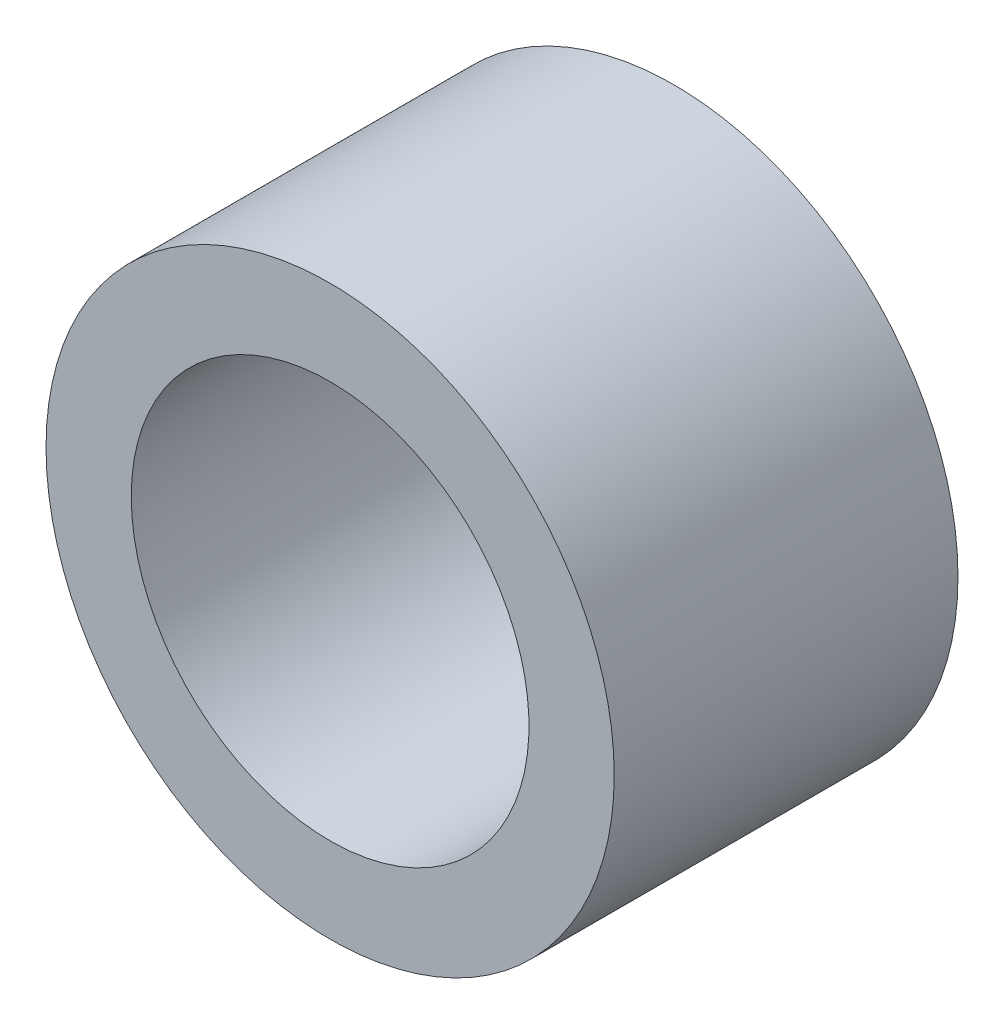
from build123d import *

# Parameters (mm, degrees)
SCHIZZO1_R                   = 100
SCHIZZO1_R_2                 = 70
ESTRUSIONE_ESTRUSIONE1_DEPTH = 121


with BuildPart() as part:
    # Schizzo1 → Estrusione-Estrusione1 (new body)
    with BuildSketch(Plane.XY):
        with Locations(Location((0, 0, 0), (0, 0, 180))):
            Circle(SCHIZZO1_R)
        with Locations(Location((0, 0, 0), (0, 0, 180))):
            Circle(SCHIZZO1_R_2, mode=Mode.SUBTRACT)
    extrude(amount=ESTRUSIONE_ESTRUSIONE1_DEPTH)


solid = part.part
